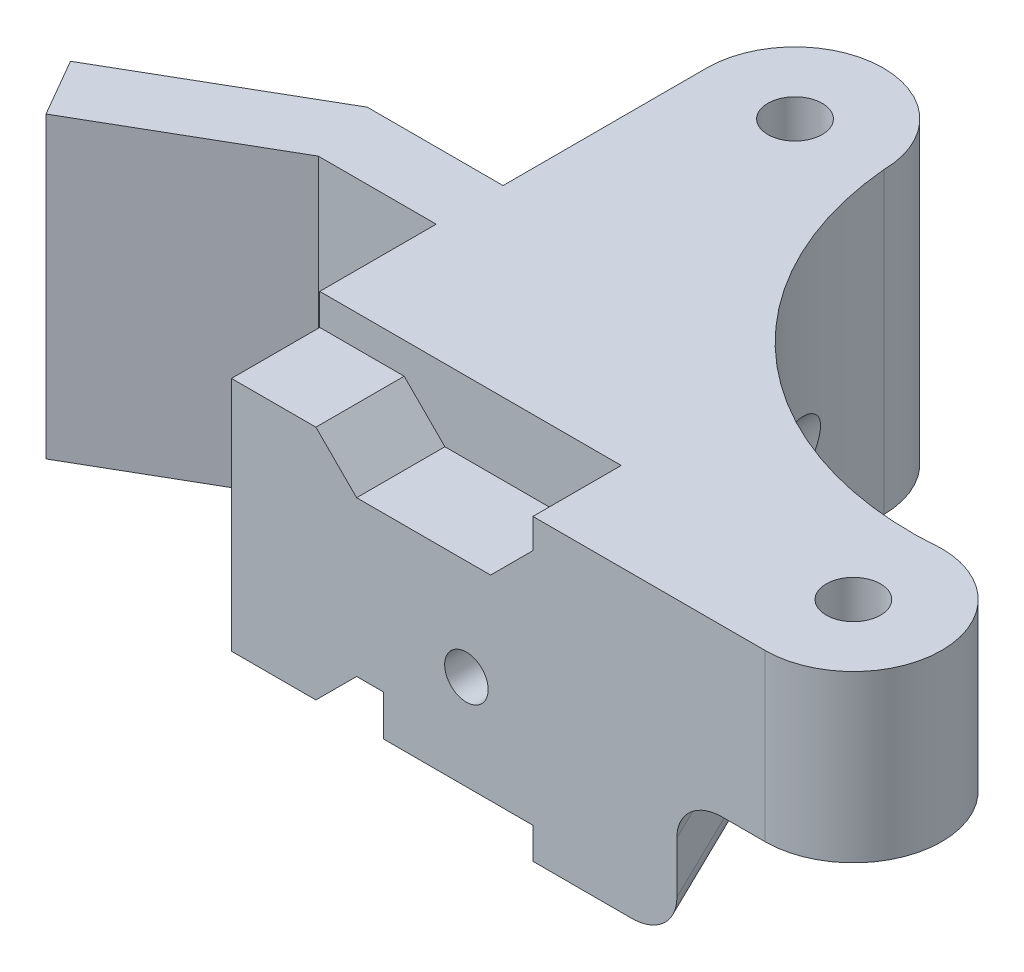
from build123d import *

# Parameters (mm, degrees)
SKETCH1_R           = 2
BOSS_EXTRUDE1_DEPTH = 22
CUT_EXTRUDE1_DEPTH  = 6.5
CUT_EXTRUDE3_DEPTH  = 9.8
FILLET2_R           = 3
SKETCH7_R           = 1.6
CUT_EXTRUDE4_DEPTH  = 62.243285382
SKETCH8_R           = 3
CUT_EXTRUDE5_DEPTH  = 54.839948035
BOSS_EXTRUDE3_DEPTH = 22


with BuildPart() as part:
    # Sketch1 → Boss-Extrude1 (new body)
    with BuildSketch(Plane(origin=(0, 0, 0), x_dir=(1, 0, 0), z_dir=(0, 1, 0))):
        with BuildLine():
            Line((-39.3, 28.5), (-39.3, -6.5))
            Line((-39.3, -6.5), (0, -6.5))
            ThreePointArc((0, -6.5), (6.5, 0), (0, 6.5))
            ThreePointArc((0, 6.5), (-17.72074287, 12.087328765), (-26.300362263, 28.568624275))
            ThreePointArc((-26.300362263, 28.568624275), (-32.834312616, 34.999909434), (-39.3, 28.5))
        make_face()
        with Locations(Location((0, 0, 0), (0, 0, 270))):
            Circle(SKETCH1_R, mode=Mode.SUBTRACT)
        with Locations(Location((-32.8, 28.5, 0), (0, 0, 270))):
            Circle(SKETCH1_R, mode=Mode.SUBTRACT)
    extrude(amount=BOSS_EXTRUDE1_DEPTH)

    # Sketch2 → Cut-Extrude1 (cut)
    with BuildSketch(Plane.XY.offset(6.5)):
        Polygon((-17.1, 2.3), (-28.1, 2.3), (-28.1, 5.3), (-30.082842712, 5.3), (-33.082842712, 2.3), (-39.3, 2.3), (-39.3, 0), (-17.1, 0), align=None)
        Polygon((-39.5, 19.7), (-33.082842712, 19.7), (-30.082842712, 16.7), (-20.217157288, 16.7), (-17.100012785, 19.817144502), (-17.099645022, 22.2), (-39.5, 22.2), align=None)
    extrude(amount=-CUT_EXTRUDE1_DEPTH, mode=Mode.SUBTRACT)

    # Sketch6 → Cut-Extrude3 (cut)
    with BuildSketch(Plane.XZ):
        with BuildLine():
            Line((-6.5, 6.5), (0, 6.5))
            ThreePointArc((0, 6.5), (6.5, 0), (0, -6.5))
            ThreePointArc((0, -6.5), (-7.470973074, -7.005610766), (-14.432472984, -9.763979833))
            Line((-14.432472984, -9.763979833), (-6.5, 6.5))
        make_face()
    extrude(amount=-CUT_EXTRUDE3_DEPTH, mode=Mode.SUBTRACT)

    # Fillet2
    fillet2_edges = [part.edges().sort_by_distance(p)[0] for p in [
        (-10.466236492, 9.8, -1.631989916),
        (-10.466236492, 0, -1.631989916),
    ]]
    fillet(fillet2_edges, radius=FILLET2_R)

    # Sketch7 → Cut-Extrude4 (cut, through all)
    with BuildSketch(Plane.XY.offset(6.5)):
        with Locations((-22, 9.3)):
            Circle(SKETCH7_R)
    extrude(amount=-CUT_EXTRUDE4_DEPTH, mode=Mode.SUBTRACT)

    # Sketch8 → Cut-Extrude5 (cut, through all)
    with BuildSketch(Plane.XY.offset(-5.5)):
        with Locations((-22, 9.3)):
            Circle(SKETCH8_R)
    extrude(amount=-CUT_EXTRUDE5_DEPTH, mode=Mode.SUBTRACT)

    # Sketch9 → Boss-Extrude3 (add)
    with BuildSketch(Plane(origin=(0, 22, 0), x_dir=(1, 0, 0), z_dir=(0, 1, 0))):
        Polygon((-39.3, 8.575003739), (-47.980351229, 8.575003739), (-60.69390833, 1.234828124), (-63.156406461, 5.5), (-49.3, 13.5), (-39.3, 13.5), align=None)
    extrude(amount=-BOSS_EXTRUDE3_DEPTH)


solid = part.part
